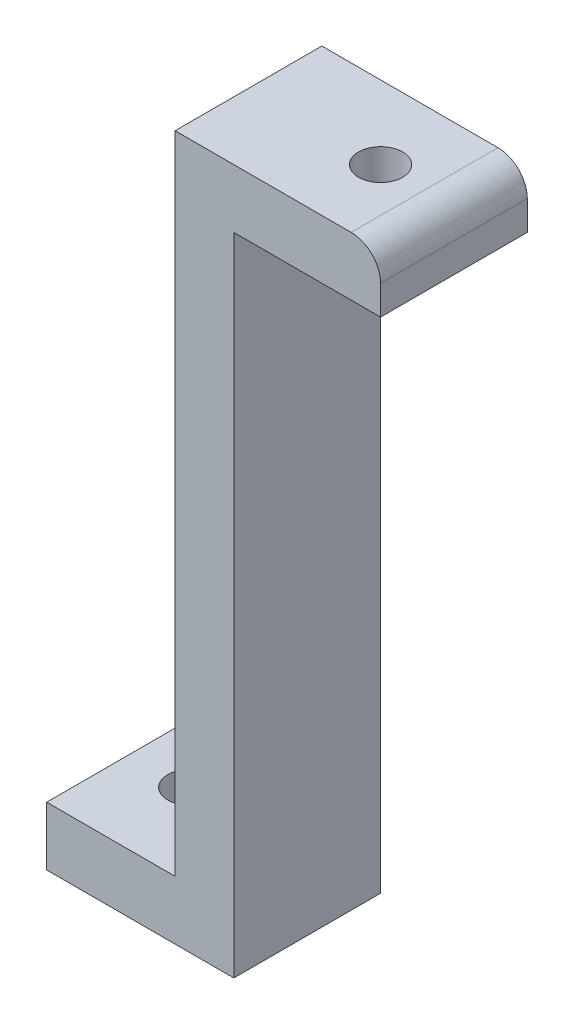
from build123d import *

# Parameters (mm, degrees)
BOSS_EXTRUDE1_DEPTH = 10
SKETCH2_R           = 1.5
CUT_EXTRUDE1_DEPTH  = 10
SKETCH3_R           = 1.5
CUT_EXTRUDE2_DEPTH  = 10
FILLET1_R           = 2


with BuildPart() as part:
    # Sketch1 → Boss-Extrude1 (new body)
    with BuildSketch(Plane.XY):
        Polygon((0, 0), (-14, 0), (-14, -44), (-22.75, -44), (-22.75, -48), (-10, -48), (-10, -4), (0, -4), align=None)
    extrude(amount=BOSS_EXTRUDE1_DEPTH)

    # Sketch2 → Cut-Extrude1 (cut)
    with BuildSketch(Plane(origin=(0, -44, 0), x_dir=(1, 0, 0), z_dir=(0, 1, 0))):
        with Locations(Location((-18.75, -4.25, 0), (0, 0, 270))):
            Circle(SKETCH2_R)
    extrude(amount=-CUT_EXTRUDE1_DEPTH, mode=Mode.SUBTRACT)

    # Sketch3 → Cut-Extrude2 (cut)
    with BuildSketch(Plane(origin=(0, -4, 0), x_dir=(-1, 0, 0), z_dir=(0, -1, 0))):
        with Locations(Location((5, -5, 0), (0, 0, 90))):
            Circle(SKETCH3_R)
    extrude(amount=-CUT_EXTRUDE2_DEPTH, mode=Mode.SUBTRACT)

    # Fillet1
    fillet1_edges = [part.edges().sort_by_distance(p)[0] for p in [
        (0, 0, 5),
    ]]
    fillet(fillet1_edges, radius=FILLET1_R)


solid = part.part
